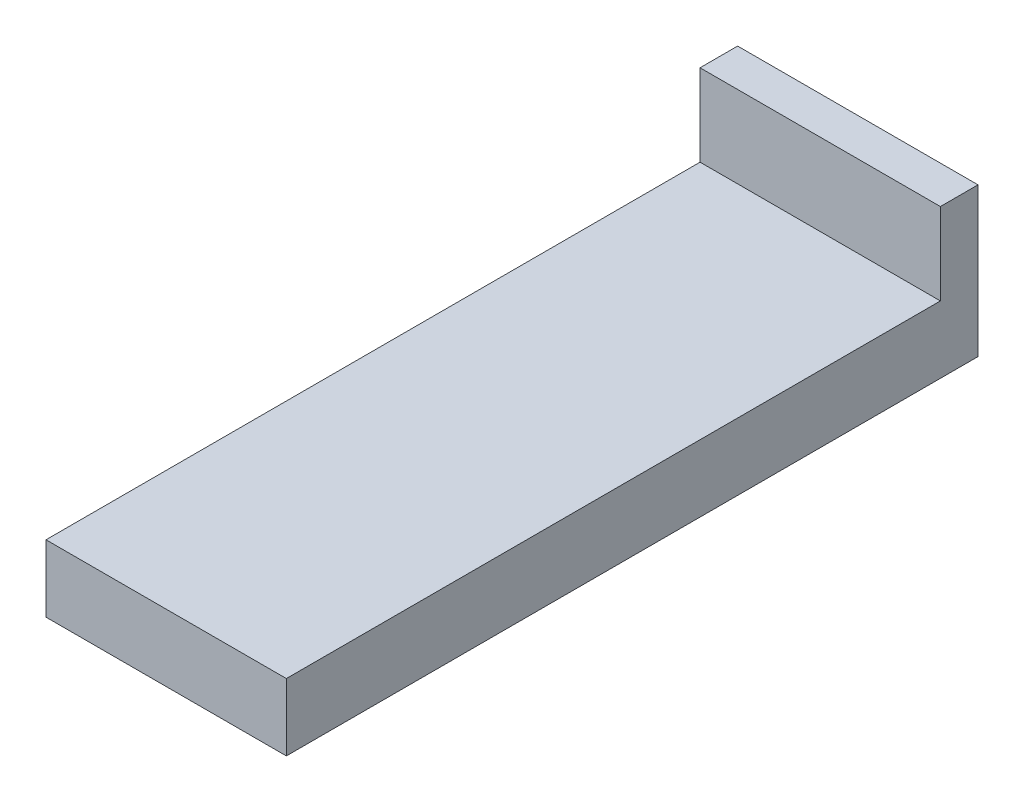
from build123d import *

# Parameters (mm, degrees)
SKETCH1_W      = 37.338
SKETCH1_H      = 101.6
EXTRUDE1_DEPTH = 10.414
SKETCH2_W      = 37.338
SKETCH2_H      = 23.114
EXTRUDE2_DEPTH = 5.842


with BuildPart() as part:
    # Sketch1 → Extrude1 (new body)
    with BuildSketch(Plane(origin=(0, 0, 0), x_dir=(1, 0, 0), z_dir=(0, 1, 0))):
        with Locations((-32.762843109, -10.345791583)):
            Rectangle(SKETCH1_W, SKETCH1_H)
    extrude(amount=EXTRUDE1_DEPTH)

    # Sketch2 → Extrude2 (add)
    with BuildSketch(Plane(origin=(0, 0, -40.454208417), x_dir=(-1, 0, 0), z_dir=(0, 0, -1))):
        with Locations((32.762843109, 11.557)):
            Rectangle(SKETCH2_W, SKETCH2_H)
    extrude(amount=EXTRUDE2_DEPTH)


solid = part.part
